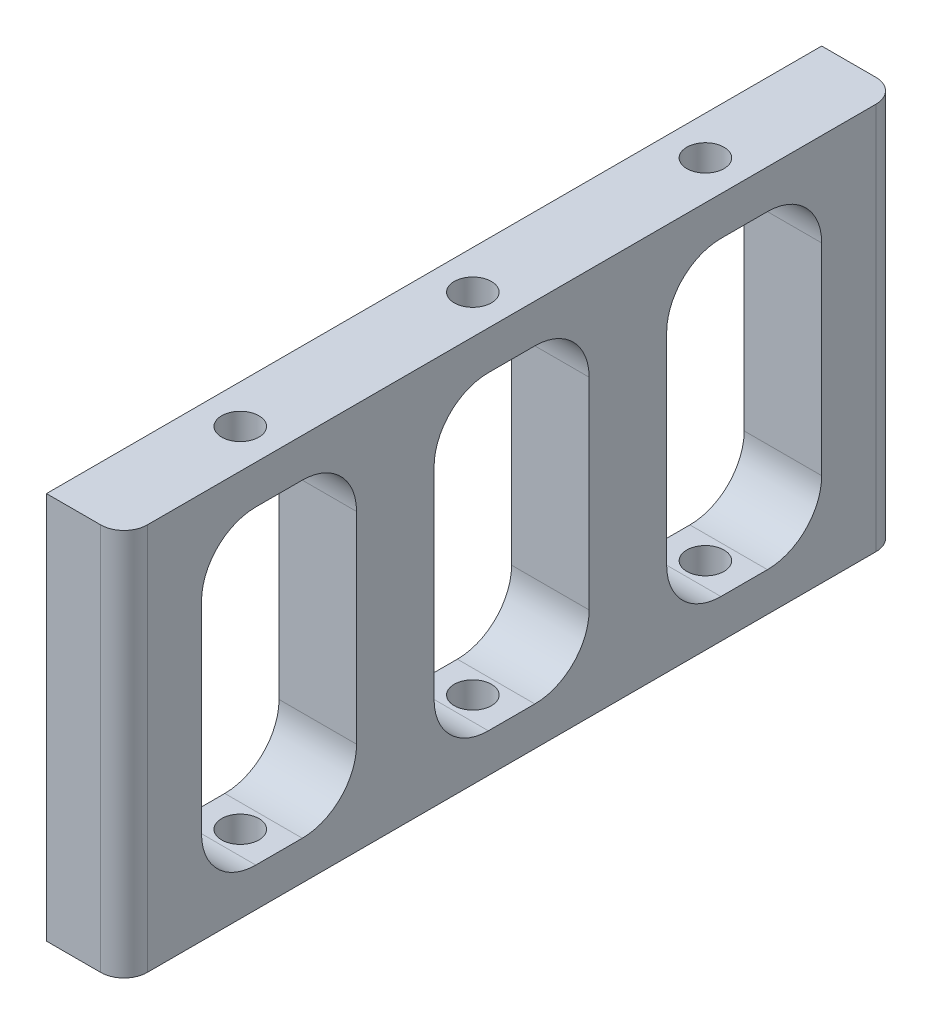
from build123d import *

# Parameters (mm, degrees)
ESQUISSE1_W             = 100
ESQUISSE1_H             = 50
ESQUISSE1_W_2           = 80
ESQUISSE1_H_2           = 40
ESQUISSE1_W_3           = 10
BOSS_EXTRU_1_DEPTH      = 10
ESQUISSE2_R             = 2.4
ENL_V_MAT_EXTRU_1_DEPTH = 113.249721603
CONG_1_R                = 7
CONG_2_R                = 3


with BuildPart() as part:
    # Esquisse1 → Boss.-Extru.1 (new body)
    # profile 1 of 3: a face of its own
    with BuildSketch(Plane(origin=(0, 0, 0), x_dir=(0, 0, -1), z_dir=(1, 0, 0))):
        with Locations((50, 25)):
            Rectangle(ESQUISSE1_W, ESQUISSE1_H)
        with Locations((50, 25)):
            Rectangle(ESQUISSE1_W_2, ESQUISSE1_H_2, mode=Mode.SUBTRACT)
    # profile 2 of 3: a face of its own
    with BuildSketch(Plane(origin=(0, 0, 0), x_dir=(0, 0, -1), z_dir=(1, 0, 0))):
        with Locations((65, 25)):
            Rectangle(ESQUISSE1_W_3, ESQUISSE1_H_2)
    # profile 3 of 3: a face of its own
    with BuildSketch(Plane(origin=(0, 0, 0), x_dir=(0, 0, -1), z_dir=(1, 0, 0))):
        with Locations((35, 25)):
            Rectangle(ESQUISSE1_W_3, ESQUISSE1_H_2)
    extrude(amount=BOSS_EXTRU_1_DEPTH)

    # Esquisse2 → Enlèv. mat.-Extru.1 (cut, through all)
    with BuildSketch(Plane.XZ):
        with Locations(Location((5, -20, 0), (0, 0, 270))):
            Circle(ESQUISSE2_R)
        with Locations(Location((5, -50, 0), (0, 0, 270))):
            Circle(ESQUISSE2_R)
        with Locations(Location((5, -80, 0), (0, 0, 270))):
            Circle(ESQUISSE2_R)
    extrude(amount=-ENL_V_MAT_EXTRU_1_DEPTH, mode=Mode.SUBTRACT)

    # Congé1
    cong_1_edges = [part.edges().sort_by_distance(p)[0] for p in [
        (5, 5, -30),
        (5, 45, -30),
        (5, 45, -10),
        (5, 5, -10),
        (5, 5, -90),
        (5, 45, -90),
        (5, 45, -70),
        (5, 5, -70),
        (5, 5, -60),
        (5, 45, -60),
        (5, 45, -40),
        (5, 5, -40),
    ]]
    fillet(cong_1_edges, radius=CONG_1_R)

    # Congé2
    cong_2_edges = [part.edges().sort_by_distance(p)[0] for p in [
        (10, 25, 0),
        (10, 25, -100),
    ]]
    fillet(cong_2_edges, radius=CONG_2_R)


solid = part.part
